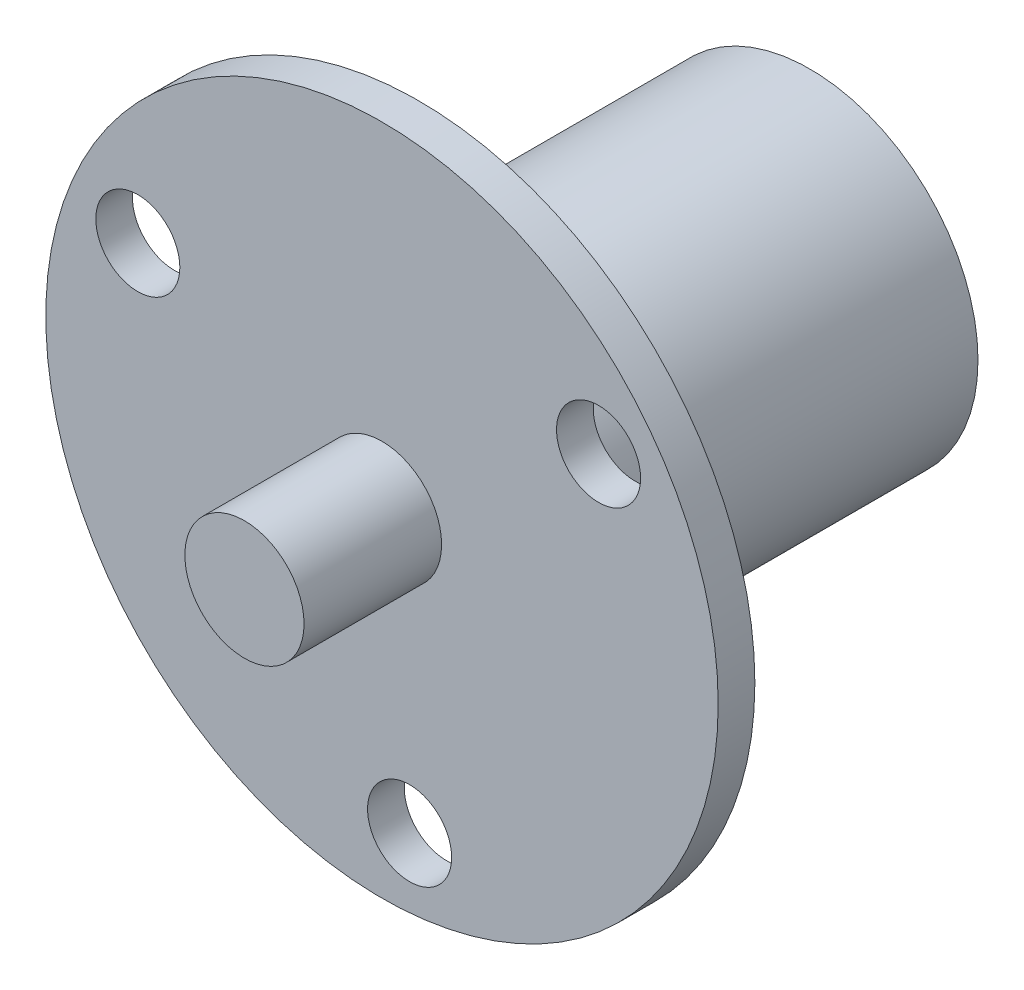
from build123d import *

# Parameters (mm, degrees)
SKETCH1_R           = 11
BOSS_EXTRUDE1_DEPTH = 25.6
SKETCH2_R           = 22
BOSS_EXTRUDE2_DEPTH = 2.4
SKETCH3_R           = 3.9
BOSS_EXTRUDE3_DEPTH = 9
SKETCH4_R           = 2.75
CUT_EXTRUDE1_DEPTH  = 9


with BuildPart() as part:
    # Sketch1 → Boss-Extrude1 (new body)
    with BuildSketch(Plane.XY):
        Circle(SKETCH1_R)
    extrude(amount=BOSS_EXTRUDE1_DEPTH)

    # Sketch2 → Boss-Extrude2 (add)
    with BuildSketch(Plane.XY.offset(25.6)):
        Circle(SKETCH2_R)
    extrude(amount=BOSS_EXTRUDE2_DEPTH)

    # Sketch3 → Boss-Extrude3 (add)
    with BuildSketch(Plane.XY.offset(28)):
        Circle(SKETCH3_R)
    extrude(amount=BOSS_EXTRUDE3_DEPTH)

    # Sketch4 → Cut-Extrude1 (cut)
    with BuildSketch(Plane.XY.offset(28)):
        with Locations((-15.977893144, 7.138412336)):
            Circle(SKETCH4_R)
        with Locations((14.170992998, 10.268055194)):
            Circle(SKETCH4_R)
        with Locations((1.806900146, -17.40646753)):
            Circle(SKETCH4_R)
    extrude(amount=-CUT_EXTRUDE1_DEPTH, mode=Mode.SUBTRACT)


solid = part.part
